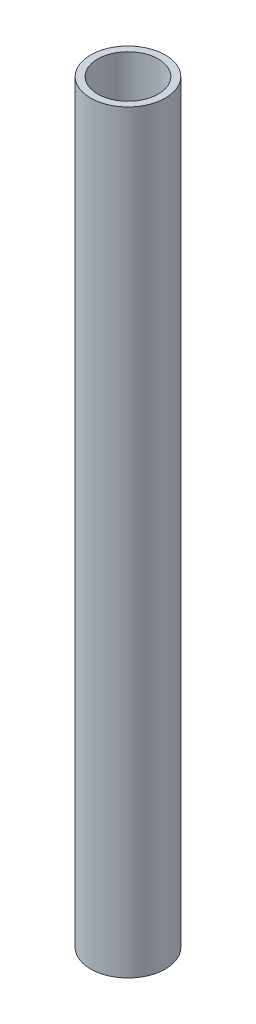
from build123d import *

# Parameters (mm, degrees)
SKETCH_1_R      = 10.65
SKETCH_1_R_2    = 8.65
EXTRUDE_1_DEPTH = 215


with BuildPart() as part:
    # Эскиз1 → Бобышка-Вытянуть1 (new body)
    with BuildSketch(Plane(origin=(0, 0, 0), x_dir=(1, 0, 0), z_dir=(0, 1, 0))):
        with Locations(Location((0, -1.5, 0), (0, 0, 270))):
            Circle(SKETCH_1_R)
        with Locations(Location((0, -1.5, 0), (0, 0, 270))):
            Circle(SKETCH_1_R_2, mode=Mode.SUBTRACT)
    extrude(amount=EXTRUDE_1_DEPTH)


solid = part.part
